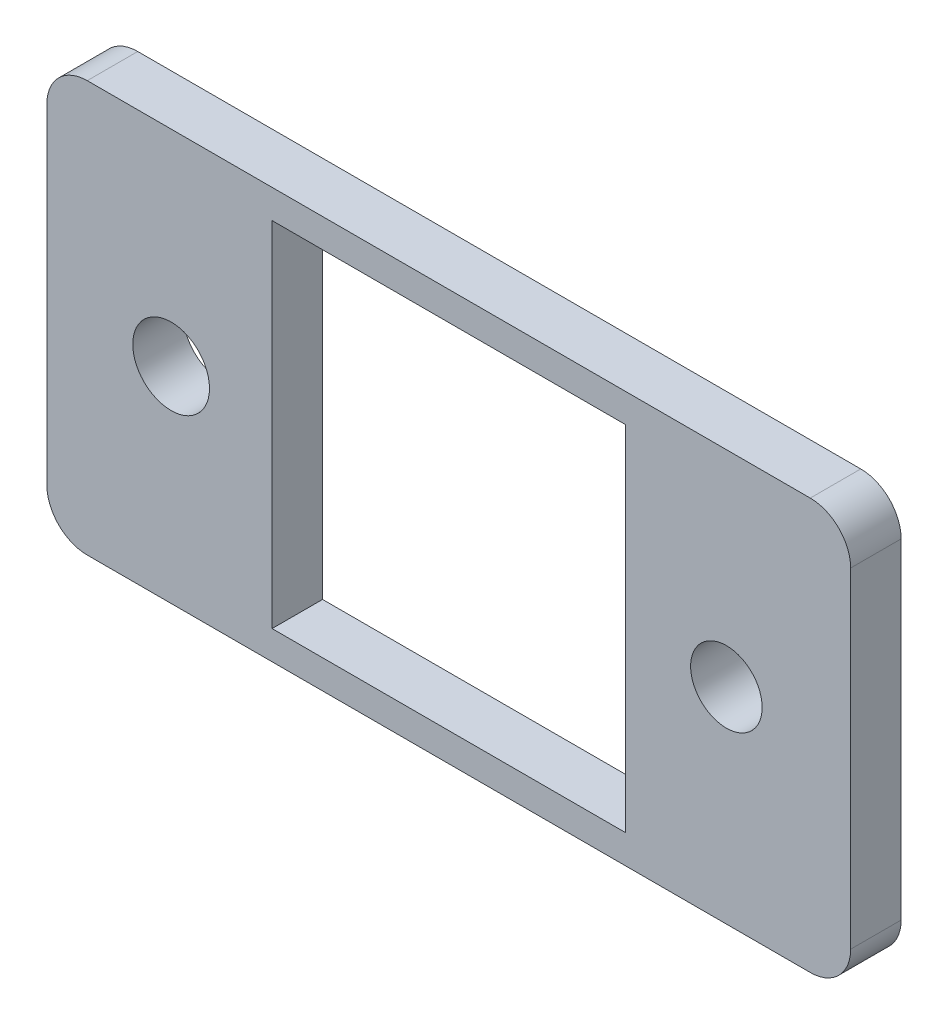
from build123d import *

# Parameters (mm, degrees)
SKETCH1_W           = 50.55571166
SKETCH1_H           = 25.842581666
SKETCH1_R           = 2.249766629
SKETCH1_R_2         = 2.413
SKETCH1_W_2         = 22.225
SKETCH1_H_2         = 22.225
BOSS_EXTRUDE1_DEPTH = 3.175
FILLET1_R           = 2.54


with BuildPart() as part:
    # Sketch1 → Boss-Extrude1 (new body)
    with BuildSketch(Plane.XY):
        Rectangle(SKETCH1_W, SKETCH1_H)
        with Locations((17.4625, 0)):
            Circle(SKETCH1_R, mode=Mode.SUBTRACT)
        with Locations((-17.4625, 0)):
            Circle(SKETCH1_R_2, mode=Mode.SUBTRACT)
        Rectangle(SKETCH1_W_2, SKETCH1_H_2, mode=Mode.SUBTRACT)
    extrude(amount=BOSS_EXTRUDE1_DEPTH)

    # Fillet1
    fillet1_edges = [part.edges().sort_by_distance(p)[0] for p in [
        (-25.27785583, -12.921290833, 1.5875),
        (-25.27785583, 12.921290833, 1.5875),
        (25.27785583, 12.921290833, 1.5875),
        (25.27785583, -12.921290833, 1.5875),
    ]]
    fillet(fillet1_edges, radius=FILLET1_R)


solid = part.part
